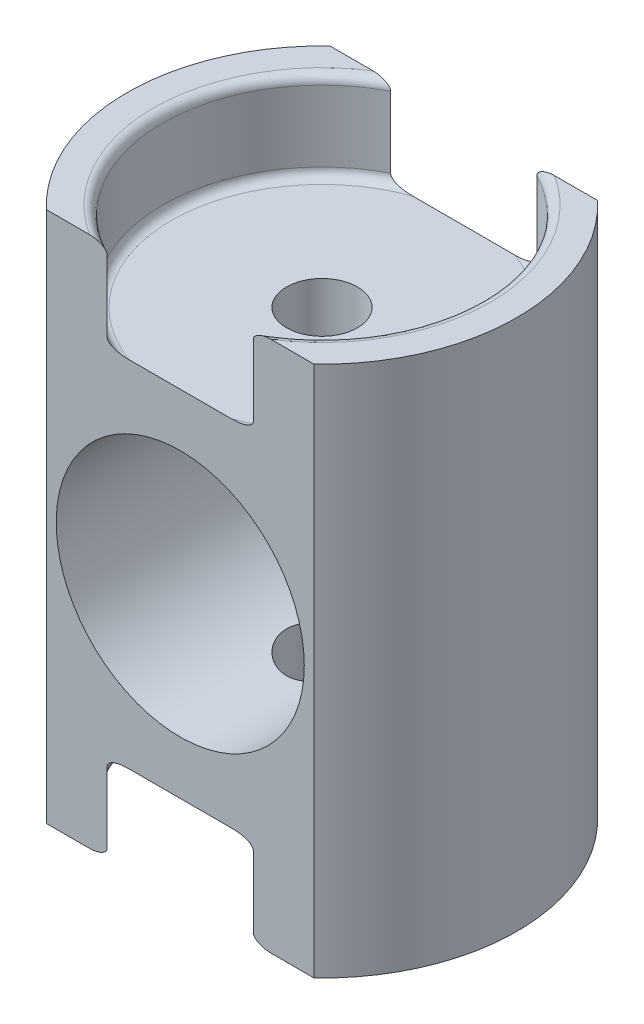
from build123d import *

# Parameters (mm, degrees)
ESQUISSE2_W             = 4
ESQUISSE2_H             = 32
ENL_V_MAT_EXTRU_1_DEPTH = 42.194659848
ESQUISSE3_R             = 7
ENL_V_MAT_EXTRU_2_DEPTH = 25.535688419


with BuildPart() as part:
    # Esquisse1 → Base-Révolution (revolve)
    with BuildSketch(Plane.XY, mode=Mode.PRIVATE) as base_r_volution_sk:
        with BuildLine():
            Line((-2, 10), (-8.5, 10))
            ThreePointArc((-8.5, 10), (-8.853553391, 10.146446609), (-9, 10.5))
            Line((-9, 10.5), (-9, 14.5))
            ThreePointArc((-9, 14.5), (-9.146446609, 14.853553391), (-9.5, 15))
            Line((-9.5, 15), (-11, 15))
            Line((-11, 15), (-11, -15))
            Line((-11, -15), (-9.5, -15))
            ThreePointArc((-9.5, -15), (-9.146446609, -14.853553391), (-9, -14.5))
            Line((-9, -14.5), (-9, -10.5))
            ThreePointArc((-9, -10.5), (-8.853553391, -10.146446609), (-8.5, -10))
            Line((-8.5, -10), (-2, -10))
            Line((-2, -10), (-2, 10))
        make_face()
    revolve(base_r_volution_sk.sketch.rotate(Axis((0, 0, 0), (0, -1, 0)), 270), axis=Axis((0, 0, 0), (0, -1, 0)))

    # Esquisse2 → Enlèv. mat.-Extru.1 (cut, through all)
    with BuildSketch(Plane(origin=(-15, 15, 0), x_dir=(0, 0, -1), z_dir=(0, -1, 0))):
        with Locations((10, 11.76635514)):
            Rectangle(ESQUISSE2_W, ESQUISSE2_H)
        with Locations((-10, 11.76635514)):
            Rectangle(ESQUISSE2_W, ESQUISSE2_H)
    extrude(amount=ENL_V_MAT_EXTRU_1_DEPTH, mode=Mode.SUBTRACT)

    # Esquisse3 → Enlèv. mat.-Extru.2 (cut, through all)
    with BuildSketch(Plane.XY.offset(8)):
        Circle(ESQUISSE3_R)
    extrude(amount=-ENL_V_MAT_EXTRU_2_DEPTH, mode=Mode.SUBTRACT)


solid = part.part
